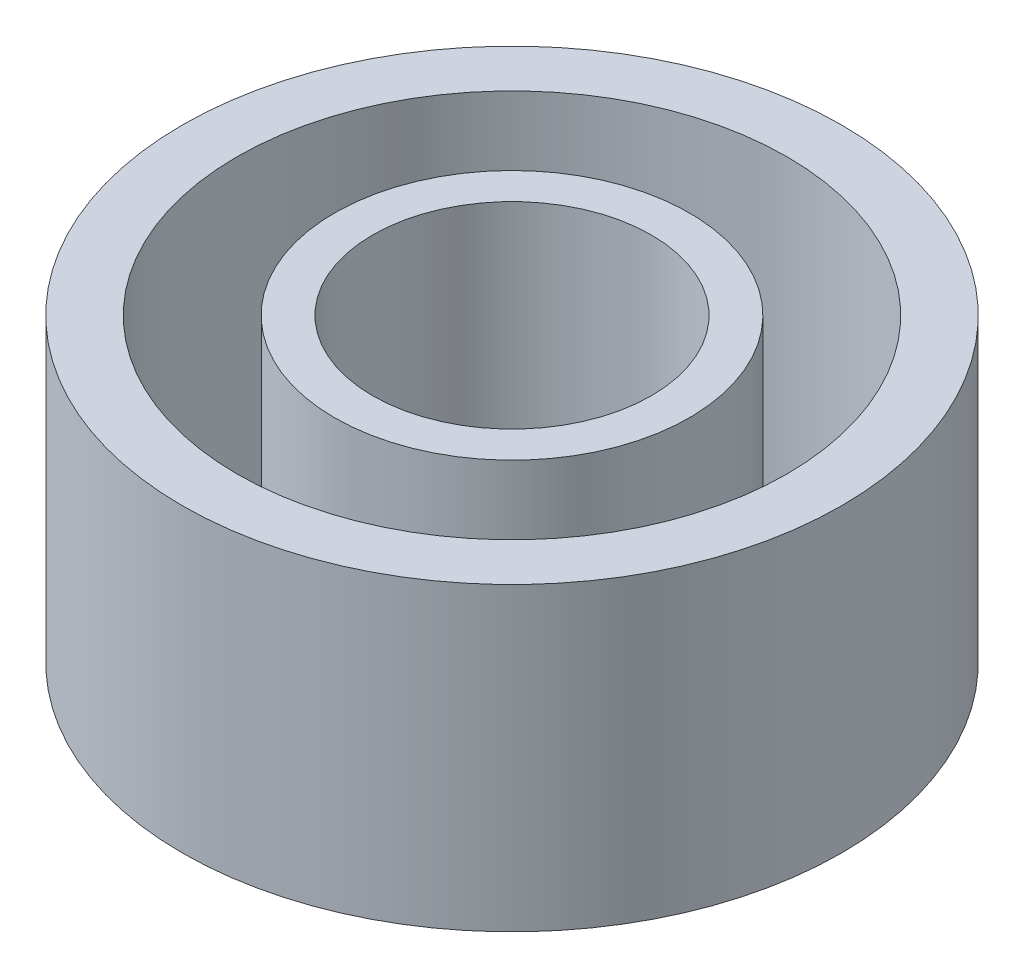
from build123d import *

# Parameters (mm, degrees)
SKETCH1_R             = 5.4991
SKETCH1_R_2           = 4.5847
BOSS_EXTRUDE1_DEPTH   = 5.0165
SKETCH1_R_3           = 2.9591
SKETCH1_R_4           = 2.3241
BOSS_EXTRUDE1_2_DEPTH = 5.0165


with BuildPart() as part:
    # Sketch1 → Boss-Extrude1 (new body)
    with BuildSketch(Plane(origin=(0, 0, 0), x_dir=(1, 0, 0), z_dir=(0, 1, 0))):
        with Locations(Location((0, 0, 0), (0, 0, 270))):
            Circle(SKETCH1_R)
        with Locations(Location((0, 0, 0), (0, 0, 270))):
            Circle(SKETCH1_R_2, mode=Mode.SUBTRACT)
    extrude(amount=BOSS_EXTRUDE1_DEPTH)


with BuildPart() as body_2:
    # Sketch1 → Boss-Extrude1 2 (new body)
    with BuildSketch(Plane(origin=(0, 0, 0), x_dir=(1, 0, 0), z_dir=(0, 1, 0))):
        with Locations(Location((0, 0, 0), (0, 0, 270))):
            Circle(SKETCH1_R_3)
        with Locations(Location((0, 0, 0), (0, 0, 270))):
            Circle(SKETCH1_R_4, mode=Mode.SUBTRACT)
    extrude(amount=BOSS_EXTRUDE1_2_DEPTH)


solid = Compound([part.part, body_2.part])
